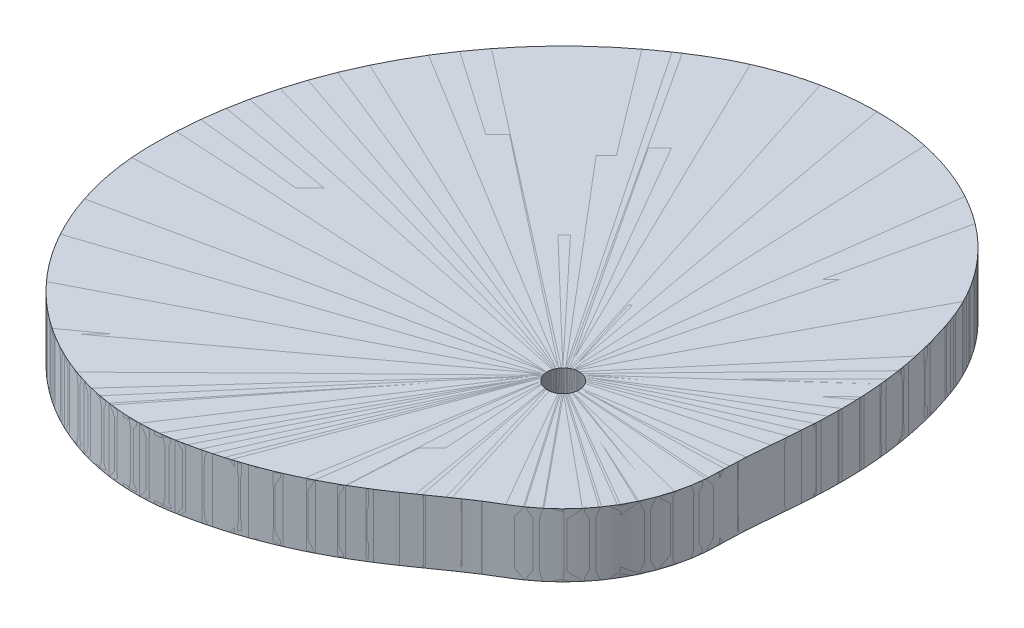
from build123d import *

# Parameters (mm, degrees)
SKETCH_1_W           = 125
SKETCH_1_H           = 20
EXTRUDE_1_DEPTH      = 10
EXTRUDE_1_DEPTH_BACK = 30
SKETCH_2_OUTSIDE_W   = 335.648
SKETCH_2_OUTSIDE_H   = 335.648
SKETCH_3_R           = 5
EXTRUDE_1_2_DEPTH    = 20


with BuildPart() as part:
    # 草图1 → 旋转1 (revolve)
    with BuildSketch(Plane.XY, mode=Mode.PRIVATE) as revolve_1_sk:
        with Locations((67.5, -10)):
            Rectangle(SKETCH_1_W, SKETCH_1_H)
    revolve(revolve_1_sk.sketch.rotate(Axis((0, -20200, 0), (0, 1, 0)), 90), axis=Axis((0, -20200, 0), (0, 1, 0)))

    # 草图2 outside → Extrude 1 (cut, two sides: drawn at the far end of the back side and taken through both)
    with BuildSketch(Plane(origin=(0, 0, 0), x_dir=(1, 0, 0), z_dir=(0, 1, 0)).offset(-EXTRUDE_1_DEPTH_BACK)):
        Rectangle(SKETCH_2_OUTSIDE_W, SKETCH_2_OUTSIDE_H)
        with BuildLine():
            ThreePointArc((49.5, 0), (49.522003902, 2.20101192), (49.586803675, 4.401179784))
            ThreePointArc((49.586803675, 4.401179784), (49.693801394, 6.656485153), (49.835800937, 8.909857504))
            ThreePointArc((49.835800937, 8.909857504), (50.014037902, 11.271336692), (50.212970941, 13.631162536))
            ThreePointArc((50.212970941, 13.631162536), (50.437148394, 16.148106857), (50.662964755, 18.664904667))
            ThreePointArc((50.662964755, 18.664904667), (50.89700113, 21.382651085), (51.110506521, 24.102087435))
            ThreePointArc((51.110506521, 24.102087435), (51.308533323, 27.06039267), (51.461958782, 30.021346081))
            ThreePointArc((51.461958782, 30.021346081), (51.569409755, 33.252730797), (51.607134457, 36.485681421))
            ThreePointArc((51.607134457, 36.485681421), (51.561933984, 40.013907512), (51.421470488, 43.539626224))
            ThreePointArc((51.421470488, 43.539626224), (51.155351471, 47.378376096), (50.768592452, 51.206853257))
            ThreePointArc((50.768592452, 51.206853257), (50.20855641, 55.358631163), (49.503236252, 59.488210272))
            ThreePointArc((49.503236252, 59.488210272), (48.573148745, 63.943471291), (47.474467997, 68.360179809))
            ThreePointArc((47.474467997, 68.360179809), (46.097521131, 73.094288239), (44.530735895, 77.769002062))
            ThreePointArc((44.530735895, 77.769002062), (42.604656504, 82.528401877), (40.298011434, 87.115455065))
            ThreePointArc((40.298011434, 87.115455065), (37.604302474, 91.545785765), (34.56817551, 95.748859775))
            ThreePointArc((34.56817551, 95.748859775), (31.174075456, 99.747159917), (27.481393941, 103.471461518))
            ThreePointArc((27.481393941, 103.471461518), (23.468076718, 106.944213921), (19.20439127, 110.104547889))
            ThreePointArc((19.20439127, 110.104547889), (14.664218285, 112.971648738), (9.924973663, 115.496128571))
            ThreePointArc((9.924973663, 115.496128571), (4.959489449, 117.692098926), (-0.151789418, 119.523259115))
            ThreePointArc((-0.151789418, 119.523259115), (-5.433965213, 120.998174308), (-10.807627759, 122.093850722))
            ThreePointArc((-10.807627759, 122.093850722), (-16.292977452, 122.813988134), (-21.815307765, 123.147944812))
            ThreePointArc((-21.815307765, 123.147944812), (-27.387630158, 123.096151544), (-32.942976067, 122.65844021))
            ThreePointArc((-32.942976067, 122.65844021), (-38.485608119, 121.834223171), (-43.958541912, 120.631268688))
            ThreePointArc((-43.958541912, 120.631268688), (-49.356557792, 119.050611025), (-54.634032237, 117.105021764))
            ThreePointArc((-54.634032237, 117.105021764), (-59.776394568, 114.79992941), (-64.75, 112.15028979))
            ThreePointArc((-64.75, 112.15028979), (-112.15028979, 64.75), (-129.5, 0))
            ThreePointArc((-129.5, 0), (-129.307852505, -5.632088462), (-128.732939877, -11.238051053))
            ThreePointArc((-128.732939877, -11.238051053), (-127.77913238, -16.781272621), (-126.449014131, -22.246420335))
            ThreePointArc((-126.449014131, -22.246420335), (-124.754336377, -27.587597274), (-122.696813244, -32.799765954))
            ThreePointArc((-122.696813244, -32.799765954), (-120.298209424, -37.829692306), (-117.556902514, -42.68136169))
            ThreePointArc((-117.556902514, -42.68136169), (-114.50652239, -47.29686169), (-111.140190251, -51.687245167))
            ThreePointArc((-111.140190251, -51.687245167), (-107.504475369, -55.793135236), (-103.586073445, -59.630176065))
            ThreePointArc((-103.586073445, -59.630176065), (-99.444602771, -63.141093315), (-95.06009455, -66.34334361))
            ThreePointArc((-95.06009455, -66.34334361), (-90.504208572, -69.185409931), (-85.751139909, -71.683764649))
            ThreePointArc((-85.751139909, -71.683764649), (-80.882367685, -73.796057576), (-75.868217271, -75.535316044))
            ThreePointArc((-75.868217271, -75.535316044), (-70.796536715, -76.871121243), (-65.636857194, -77.811348042))
            ThreePointArc((-65.636857194, -77.811348042), (-60.478824845, -78.339174116), (-55.295191431, -78.456829156))
            ThreePointArc((-55.295191431, -78.456829156), (-50.169364307, -78.160915791), (-45.084563465, -77.449249565))
            ThreePointArc((-45.084563465, -77.449249565), (-40.252749921, -76.46876847), (-35.464418323, -75.29418522))
            ThreePointArc((-35.464418323, -75.29418522), (-31.090096172, -74.0373164), (-26.766683195, -72.615165299))
            ThreePointArc((-26.766683195, -72.615165299), (-22.837702701, -71.161200919), (-18.962139542, -69.570317407))
            ThreePointArc((-18.962139542, -69.570317407), (-15.453201553, -67.991021962), (-11.995687137, -66.302112854))
            ThreePointArc((-11.995687137, -66.302112854), (-8.872093418, -64.660898454), (-5.793959756, -62.935930167))
            ThreePointArc((-5.793959756, -62.935930167), (-3.013004738, -61.286784304), (-0.268268971, -59.578036674))
            ThreePointArc((-0.268268971, -59.578036674), (2.219279173, -57.964689623), (4.682233258, -56.314040765))
            ThreePointArc((4.682233258, -56.314040765), (6.930581526, -54.769421498), (9.167200776, -53.207866842))
            ThreePointArc((9.167200776, -53.207866842), (11.233903436, -51.753905232), (13.301552432, -50.301289702))
            ThreePointArc((13.301552432, -50.301289702), (15.245755041, -48.949095714), (17.201737526, -47.613998381))
            ThreePointArc((17.201737526, -47.613998381), (19.082215454, -46.364336995), (20.981868338, -45.144021567))
            ThreePointArc((20.981868338, -45.144021567), (22.854869714, -43.987819385), (24.75, -42.868257487))
            ThreePointArc((24.75, -42.868257487), (42.868257487, -24.75), (49.5, 0))
        make_face(mode=Mode.SUBTRACT)
    extrude(amount=EXTRUDE_1_DEPTH + EXTRUDE_1_DEPTH_BACK, mode=Mode.SUBTRACT)


with BuildPart() as body_2:
    # 草图3 → Extrude 1 2 (new body)
    with BuildSketch(Plane(origin=(0, 0, 0), x_dir=(1, 0, 0), z_dir=(0, 1, 0))):
        with BuildLine():
            add(Edge.make_bspline(
                [(20.02967354, -45.750492484), (19.396443191, -46.157272465), (18.766389748, -46.568955942), (18.13955118, -46.985518105), (18.035079397, -47.054944261), (17.826315483, -47.194066912), (17.513570884, -47.40335867), (17.305649352, -47.543736891), (17.201737526, -47.613998381), (17.092747481, -47.687693583), (16.874875072, -47.835243239), (16.548389417, -48.057045545), (16.330949129, -48.205231269), (16.222283174, -48.279403522), (15.570284837, -48.724438817), (14.920243579, -49.172327875), (14.272171891, -49.623062092), (14.164160374, -49.698184161), (13.948247107, -49.848586124), (13.62459849, -50.074508861), (13.409231879, -50.225692444), (13.301552419, -50.301289712), (13.186656761, -50.38195317), (12.9568742, -50.543292558), (12.612226621, -50.785339047), (12.382479085, -50.946728306), (12.267609697, -51.027429169), (11.57839334, -51.511634363), (10.88933467, -51.996063929), (10.200433759, -52.480717816), (9.961671734, -52.648691093), (9.484185591, -52.984691533), (8.768046515, -53.488824211), (8.289727415, -53.823638559), (8.050365266, -53.99075555), (7.304821973, -54.511276242), (6.557318505, -55.028978047), (5.80786552, -55.543853584), (5.68295706, -55.629665918), (5.433032131, -55.801133368), (5.057820634, -56.057862938), (4.807464855, -56.228700698), (4.682233257, -56.314040766), (4.546114879, -56.406799717), (4.27375122, -56.592131397), (3.864130501, -56.868550928), (3.590697316, -57.052301325), (3.453865562, -57.14400469), (2.63286533, -57.694231389), (1.807742589, -58.238256445), (0.978544182, -58.776048973), (0.840346082, -58.86568), (0.563724765, -59.044594958), (0.148117104, -59.3119263), (-0.129399447, -59.489449478), (-0.268268971, -59.578036674), (-0.41970353, -59.674639318), (-0.72283723, -59.86742985), (-1.178907914, -60.154468013), (-1.483541683, -60.344879857), (-1.636029221, -60.439811661), (-2.550976623, -61.009416293), (-3.472014376, -61.569119467), (-4.39903533, -62.118856072), (-4.553535078, -62.210476619), (-4.862863975, -62.393162244), (-5.327846296, -62.665524676), (-5.638480806, -62.845981333), (-5.793959756, -62.935930167), (-5.963642857, -63.034096491), (-6.303394236, -63.229763347), (-6.814600367, -63.520535283), (-7.156191635, -63.712972575), (-7.327202959, -63.808806331), (-8.353309886, -64.383830713), (-9.387088209, -64.944946428), (-10.428349409, -65.492051151), (-10.601886349, -65.583231807), (-10.949370664, -65.764811972), (-11.471829806, -66.034839379), (-11.820934744, -66.213283902), (-11.995687137, -66.302112854), (-12.18626196, -66.398984556), (-12.567887137, -66.591792449), (-13.14202307, -66.877666185), (-13.525711142, -67.066335946), (-13.71780122, -67.160167133), (-14.870401126, -67.72318329), (-16.031716064, -68.267996424), (-17.201458575, -68.794471678), (-17.396405607, -68.882213029), (-17.786759816, -69.05667336), (-18.373673649, -69.315297494), (-18.765836243, -69.48565393), (-18.962139542, -69.570317407), (-19.175861758, -69.662493472), (-19.603832486, -69.845625312), (-20.247509004, -70.116339159), (-20.67762689, -70.294369789), (-20.892944236, -70.382755606), (-22.184931139, -70.913104507), (-23.486022019, -71.420709308), (-24.795816527, -71.905413816), (-25.014101617, -71.986192722), (-25.451144125, -72.146474185), (-26.108103512, -72.383136958), (-26.547007167, -72.538249405), (-26.766683196, -72.6151653), (-27.005339101, -72.698726681), (-27.483180144, -72.86433793), (-28.201533111, -73.108221176), (-28.681433591, -73.267766393), (-28.921634041, -73.346778353), (-30.362945144, -73.820885773), (-31.813003875, -74.267523452), (-33.271286745, -74.686530148), (-33.51431561, -74.756359344), (-34.000815598, -74.894478528), (-34.731874933, -75.09711935), (-35.220102317, -75.229002134), (-35.464418323, -75.29418522), (-35.729079727, -75.364796424), (-36.258877362, -75.504239109), (-37.055002901, -75.708064721), (-37.586627985, -75.840369547), (-37.852659941, -75.905627492), (-39.448987027, -76.297208363), (-41.052888459, -76.656507598), (-42.663711494, -76.983378972), (-42.932159237, -77.037852915), (-43.469421033, -77.14499562), (-44.276417304, -77.300294596), (-44.815071471, -77.400201977), (-45.084563465, -77.449249565), (-45.3652539, -77.500335272), (-45.926992572, -77.600540744), (-46.772616664, -77.734353434), (-47.337175116, -77.817276339), (-47.619722541, -77.856821538), (-49.315592201, -78.094174622), (-51.019714252, -78.262336522), (-52.729266892, -78.361028784), (-53.014094026, -78.377471819), (-53.58397133, -78.406494459), (-54.439473508, -78.438591884), (-55.009931036, -78.451994186), (-55.295191431, -78.456829156), (-55.583260451, -78.461711731), (-56.159463004, -78.467670662), (-57.023979274, -78.465186982), (-57.600138077, -78.455917417), (-57.888174288, -78.449379742), (-59.616957525, -78.410140844), (-61.342827543, -78.302419658), (-63.063072621, -78.126385437), (-63.34443353, -78.097593523), (-63.906781897, -78.036360241), (-64.749221659, -77.933699361), (-65.30977265, -77.857759724), (-65.589799881, -77.818039633), (-65.883563239, -77.776371158), (-66.470543519, -77.689181815), (-67.349393021, -77.546834209), (-67.933884612, -77.444279782), (-68.225781634, -77.39108861), (-69.94653127, -77.077523607), (-71.653881798, -76.697712477), (-73.345283839, -76.252222345), (-73.617145111, -76.180618131), (-74.15997792, -76.034031631), (-74.971614448, -75.804147739), (-75.51059716, -75.64398578), (-75.779598843, -75.562292396), (-76.071619007, -75.473608506), (-76.654505212, -75.29244041), (-77.525389581, -75.009278067), (-78.103362969, -74.813000276), (-78.39169887, -74.712985196), (-80.063875617, -74.13295721), (-81.712984665, -73.490269971), (-83.336679016, -72.785838149), (-83.593650873, -72.67435217), (-84.106262931, -72.448310786), (-84.871257719, -72.100155902), (-85.378268365, -71.861817267), (-85.63107713, -71.741188138), (-85.913702996, -71.606331611), (-86.477213616, -71.33296962), (-87.317272228, -70.911967977), (-87.873536365, -70.624146492), (-88.150727877, -70.478446362), (-89.735803666, -69.645283229), (-91.289058431, -68.754202034), (-92.808376806, -67.806416333), (-93.045212546, -67.658672759), (-93.517183702, -67.360459958), (-94.220120919, -66.905060112), (-94.685037697, -66.595965594), (-94.916626461, -66.44012601), (-95.182867737, -66.260968228), (-95.713051613, -65.899236668), (-96.501445694, -65.346377129), (-97.022172726, -64.971159828), (-97.281322025, -64.781888677), (-98.74346293, -63.714005825), (-100.166011218, -62.59392271), (-101.547104234, -61.423105946), (-101.758835264, -61.243611708), (-102.180305307, -60.88227345), (-102.806619608, -60.333291799), (-103.21989597, -59.962610695), (-103.425527214, -59.776159623), (-103.669131163, -59.555277736), (-104.153512732, -59.11039689), (-104.87161844, -58.433707985), (-105.344456405, -57.976577008), (-105.579403449, -57.746508369), (-106.886088596, -56.466955031), (-108.146436795, -55.141736092), (-109.358853165, -53.772528524), (-109.540904118, -53.566934514), (-109.9028091, -53.153801145), (-110.439159046, -52.528318934), (-110.792083771, -52.107488628), (-110.967442779, -51.896157928), (-111.182972851, -51.636415804), (-111.610699464, -51.114165441), (-112.242298994, -50.322472963), (-112.656479689, -49.789415886), (-112.861851265, -49.521569477), (-113.98442211, -48.057508213), (-115.054970903, -46.554988341), (-116.072181222, -45.015857466), (-116.220463011, -44.791493758), (-116.514732208, -44.341249986), (-116.949328664, -43.661369775), (-117.234265817, -43.205163293), (-117.375586175, -42.976350882), (-117.558505556, -42.680185311), (-117.920496942, -42.085477932), (-118.451949803, -41.186267173), (-118.798367915, -40.582355655), (-118.969608449, -40.279287635), (-119.883743587, -38.66141645), (-120.741253882, -37.012833328), (-121.54110888, -35.335519343), (-121.652068468, -35.102834582), (-121.871749153, -34.636397598), (-122.194618269, -33.933558122), (-122.405232605, -33.46295798), (-122.509421559, -33.227163811), (-122.656214719, -32.894950367), (-122.945361649, -32.228561873), (-123.365769234, -31.223070119), (-123.637003096, -30.549191967), (-123.770362804, -30.211361843), (-124.456473965, -28.473288017), (-125.082456746, -26.712664631), (-125.647571812, -24.931571115), (-125.718102316, -24.709277584), (-125.857255919, -24.264085331), (-126.060310956, -23.594488287), (-126.191767571, -23.146962924), (-126.256543805, -22.922924969), (-126.365052257, -22.547632829), (-126.576726028, -21.795503687), (-126.878209428, -20.66264513), (-127.068381121, -19.90479372), (-127.160764853, -19.525210369), (-127.604310219, -17.702785221), (-127.985335138, -15.866270608), (-128.303394751, -14.01781071), (-128.347923311, -13.75902508), (-128.434503926, -13.241027694), (-128.556971068, -12.462747808), (-128.633600133, -11.943185096), (-128.670677671, -11.683227309), (-128.721941532, -11.323806476), (-128.819739937, -10.604290273), (-128.952248312, -9.522968386), (-129.031078033, -8.801127705), (-129.068116767, -8.439963683), (-129.259828378, -6.570587247), (-129.387795304, -4.695768305), (-129.451869224, -2.81767988), (-129.462545632, -2.504740734), (-129.480347116, -1.878741283), (-129.49772869, -0.939363643), (-129.5, -0.313121214), (-129.5, 0), (-129.5, 0.314010981), (-129.497715763, 0.942032944), (-129.487436017, 1.884072118), (-129.476015104, 2.511994379), (-129.469162801, 2.825930587), (-128.481878812, 48.058050592), (-105.860432075, 87.239545681), (-67.181909078, 110.710618699), (-66.913458499, 110.873521071), (-66.375372325, 111.197373002), (-65.564682343, 111.67729511), (-65.021941488, 111.993284299), (-64.750000001, 112.15028979), (-64.478829074, 112.306850397), (-63.935351567, 112.618004599), (-63.11313588, 113.072640535), (-62.56210371, 113.370223723), (-62.285752256, 113.517447256), (-60.627243009, 114.401001826), (-58.939618715, 115.227588688), (-57.224835427, 115.996249781), (-56.893538843, 116.144755307), (-56.228991614, 116.437407106), (-55.226285203, 116.863312431), (-54.55426669, 117.138374629), (-54.217367188, 117.27368924), (-53.973698371, 117.371558043), (-53.485429331, 117.564976683), (-52.750185608, 117.848056969), (-52.258296405, 118.032074651), (-52.011917195, 118.122904602), (-50.252074159, 118.771686845), (-48.47109339, 119.359966893), (-46.671054232, 119.887057912), (-46.296133542, 119.996842928), (-45.544729122, 120.211075116), (-44.412903133, 120.516412111), (-43.655703304, 120.70916182), (-43.276436551, 120.802836814), (-43.050025874, 120.858757927), (-42.596729233, 120.96867584), (-41.915313664, 121.127623542), (-41.460189061, 121.229709113), (-41.232411964, 121.27977467), (-39.4073822, 121.680917425), (-37.569646231, 122.019112128), (-35.721374563, 122.293959346), (-35.36212524, 122.347381512), (-34.642912709, 122.449425174), (-33.561927515, 122.588087402), (-32.840244685, 122.670873062), (-32.479142823, 122.709853178), (-32.222844605, 122.737519982), (-31.70998576, 122.790422688), (-30.939874361, 122.862229569), (-30.426087741, 122.905199007), (-30.169097033, 122.925447566), (-28.316573013, 123.071409811), (-26.460103001, 123.153075672), (-24.601917886, 123.170347013), (-24.253833015, 123.17358237), (-23.557621242, 123.175531244), (-22.513155451, 123.164884945), (-21.81712806, 123.148744898), (-21.469181461, 123.138414853), (-21.200363922, 123.130434038), (-20.662808942, 123.111774466), (-19.85671718, 123.075343001), (-19.319660038, 123.045620286), (-19.051214472, 123.029386344), (-17.209682875, 122.918021804), (-15.3731881, 122.742159289), (-13.543988431, 122.502015052), (-13.209340848, 122.458081255), (-12.54060953, 122.365918789), (-11.539183966, 122.21478379), (-10.873038579, 122.10548686), (-10.540330265, 122.048703403), (-10.269633006, 122.002503398), (-9.728720908, 121.907276774), (-8.91886245, 121.755525201), (-8.380125967, 121.648672977), (-8.111050855, 121.593809231), (-6.319074133, 121.22842964), (-4.541226767, 120.799545551), (-2.779758497, 120.307699687), (-2.463039689, 120.219263899), (-1.830733668, 120.038339697), (-0.885651032, 119.754786364), (-0.258182133, 119.557740044), (0.054909167, 119.457213779), (0.319196154, 119.372357434), (0.846853588, 119.199790157), (1.635442794, 118.931876888), (2.159105926, 118.747542252), (2.420418012, 118.653924921), (4.124921581, 118.043271666), (5.806216156, 117.371350268), (7.462100287, 116.639040526), (7.755588562, 116.509246225), (8.340899792, 116.245892037), (9.213887237, 115.839552505), (9.792247896, 115.561265579), (10.080523725, 115.420272762), (10.331279145, 115.297630801), (10.831421239, 115.04954832), (11.577277683, 114.668486755), (12.071523122, 114.408854145), (12.317890681, 114.277620165), (13.898356363, 113.435744706), (15.446682697, 112.536127219), (16.96076103, 111.579992885), (17.2255368, 111.412788058), (17.752929586, 111.074959927), (18.53755701, 110.55794865), (19.056050749, 110.206615133), (19.31415286, 110.029282217), (19.545025133, 109.870657969), (20.004937768, 109.550743187), (20.688946136, 109.062315708), (21.141009746, 108.731401336), (21.366045364, 108.564600169), (22.787948394, 107.510655525), (24.169086393, 106.403828815), (25.507493737, 105.245695265), (25.738277288, 105.04599659), (26.197245535, 104.643595849), (26.877913502, 104.030969033), (27.326252779, 103.61675882), (27.549065362, 103.408203884), (27.75431475, 103.216088285), (28.16251043, 102.829396544), (28.767413985, 102.241440638), (29.165778022, 101.844626886), (29.363719727, 101.644990225), (30.595226518, 100.402938156), (31.77782787, 99.11423479), (32.909757946, 97.780804393), (33.101771363, 97.554609743), (33.482831897, 97.09970239), (34.045533291, 96.409770199), (34.414531616, 95.945025038), (34.597499253, 95.711452744), (34.771911477, 95.488802094), (35.117952627, 95.041320513), (35.628079439, 94.363076718), (35.9622832, 93.906685387), (36.127898184, 93.677415649), (37.14047083, 92.275656821), (38.096695123, 90.834870135), (38.995068624, 89.357319383), (39.144748522, 89.111141545), (39.440855602, 88.616808167), (39.875264667, 87.869356955), (40.158205358, 87.367371441), (40.298011434, 87.115455064), (40.436454424, 86.865994831), (40.710076454, 86.365262968), (41.110030358, 85.608327637), (41.369834667, 85.100288095), (41.498008148, 84.845399043), (42.267314461, 83.315536897), (42.973743009, 81.75564296), (43.616124039, 80.168300211), (43.723150605, 79.903834364), (43.933616489, 79.373450949), (44.240543346, 78.574212659), (44.434632197, 78.037629963), (44.530735895, 77.769002062), (44.623005434, 77.511091355), (44.805810188, 76.994649471), (45.074815465, 76.218120712), (45.250658059, 75.699266996), (45.337706112, 75.43954746), (45.860038715, 73.881098103), (46.350827167, 72.3124291), (46.809871728, 70.734178855), (46.886372668, 70.471159451), (47.037605869, 69.94460621), (47.259150481, 69.153228463), (47.40328839, 68.62468891), (47.474467997, 68.360179809), (47.540175791, 68.116004397), (47.670075641, 67.627245688), (47.860113209, 66.892809321), (47.983748482, 66.402428381), (48.044789056, 66.157044612), (48.411060048, 64.684631252), (48.749289838, 63.205524715), (49.059356319, 61.720258975), (49.111030179, 61.472733304), (49.212810209, 60.977354688), (49.360777606, 60.233301146), (49.456274578, 59.73667304), (49.503236252, 59.488210272), (49.546463147, 59.259507304), (49.631583656, 58.801849365), (49.755107375, 58.11457446), (49.834820811, 57.655943814), (49.874006771, 57.426513928), (50.109137607, 56.049846356), (50.320084395, 54.669266201), (50.506782225, 53.285198271), (50.537896535, 53.054535071), (50.59877643, 52.59302674), (50.686169621, 51.9002296), (50.741558159, 51.438030157), (50.768592452, 51.206853257), (50.793423381, 50.994517875), (50.841971677, 50.569716888), (50.911453523, 49.932122531), (50.955543549, 49.506835704), (50.977030826, 49.294135948), (51.105961137, 48.01787159), (51.214796591, 46.739736785), (51.30351025, 45.460047907), (51.318295097, 45.246777427), (51.346746327, 44.820158929), (51.386240376, 44.180005757), (51.410076432, 43.753104712), (51.421470488, 43.539626224), (51.431918555, 43.343871736), (51.451933534, 42.952315729), (51.479312511, 42.364839137), (51.495801633, 41.97311881), (51.503605338, 41.777241083), (51.55042935, 40.60193007), (51.581378047, 39.426093923), (51.596445788, 38.249947067), (51.598956983, 38.053930038), (51.603097034, 37.661884676), (51.606884216, 37.073781212), (51.607307437, 36.681714458), (51.607134457, 36.485681421), (51.606975957, 36.306058283), (51.606013163, 35.946812578), (51.602631538, 35.407944859), (51.599085595, 35.048715364), (51.596989748, 34.869104384), (51.584414359, 33.791412385), (51.560216068, 32.713918707), (51.524397688, 31.636748698), (51.518428102, 31.457224714), (51.505843493, 31.098198209), (51.485296494, 30.559710329), (51.469901846, 30.200793579), (51.461958782, 30.021346081), (51.454674781, 29.856787948), (51.439693475, 29.527689975), (51.415981572, 29.034097511), (51.399347333, 28.705078945), (51.390823635, 28.540580366), (51.339680848, 27.553577217), (51.2811027, 26.566987434), (51.215092517, 25.580867027), (51.204090949, 25.41651557), (51.181675031, 25.087840287), (51.147099053, 24.594888572), (51.12277894, 24.266348884), (51.110506521, 24.102087435), (51.099215654, 23.950963657), (51.076443703, 23.648730312), (51.041715123, 23.195422839), (51.018182419, 22.893247776), (51.006320987, 22.74216771), (50.935152186, 21.835684618), (50.860561005, 20.929476723), (50.782548509, 20.023556944), (50.757502024, 19.732704747), (50.706703843, 19.151061082), (50.628181675, 18.278800111), (50.57593983, 17.697284761), (50.549851717, 17.406524143), (50.474579594, 16.56759151), (50.399580619, 15.728634414), (50.324854798, 14.889652943), (50.312400496, 14.749822703), (50.287507065, 14.470160871), (50.250212446, 14.050664068), (50.225379718, 13.770996839), (50.212970943, 13.631162552), (50.201341519, 13.500110769), (50.178096001, 13.238006022), (50.144265479, 12.844756729), (50.121970193, 12.582569373), (50.110918331, 12.451467621), (50.044606893, 11.664853968), (49.981744219, 10.877957195), (49.922331516, 10.090792424), (49.912429439, 9.959598821), (49.892816981, 9.697197146), (49.863973377, 9.303551122), (49.845127831, 9.041093253), (49.835800937, 8.909857504), (49.826908615, 8.784736478), (49.809298275, 8.534482039), (49.784418595, 8.158991391), (49.768316802, 7.908635214), (49.760427879, 7.783446918), (49.713093747, 7.032307712), (49.67159212, 6.280823686), (49.635925497, 5.529040127), (49.629981134, 5.403744441), (49.618416634, 5.153137685), (49.602042556, 4.777181091), (49.59177519, 4.526517841), (49.586803675, 4.401179784), (49.58195703, 4.278989872), (49.572571986, 4.03459782), (49.560251719, 3.667940682), (49.552655486, 3.423486365), (49.549055457, 3.301253372), (49.527454851, 2.567840971), (49.512986432, 1.834253211), (49.505651567, 1.100559449), (49.503203199, 0.855653421), (49.499896253, 0.365825472), (49.500442653, -0.368978597), (49.493156006, -0.85877442), (49.487695408, -1.103631805), (49.102520818, -18.375155434), (40.464611813, -33.336452702), (25.699620884, -42.305785496), (25.490298467, -42.432943205), (25.069766165, -42.684151538), (24.433133974, -43.051080376), (24.010584, -43.29885825), (23.799713343, -43.423431613), (23.167983339, -43.796630673), (22.539911912, -44.175954571), (21.915558444, -44.561367445), (21.811501582, -44.625601659), (21.60359605, -44.754407347), (21.292221787, -44.948405581), (21.085264583, -45.078729293), (20.981868338, -45.144021567), (20.875808154, -45.210996054), (20.663861095, -45.345219479), (20.346460172, -45.547378143), (20.135210606, -45.682696672), (20.02967354, -45.750492484)],
                knots=[0, 0, 0, 0, 0.003776693, 0.003776693, 0.003776693, 0.004406147, 0.0050356, 0.005665054, 0.005665054, 0.005665054, 0.006325269, 0.006985485, 0.0076457, 0.0076457, 0.0076457, 0.011606982, 0.011606982, 0.011606982, 0.012267198, 0.012927413, 0.013587628, 0.013587628, 0.013587628, 0.014292088, 0.014996548, 0.015701008, 0.015701008, 0.015701008, 0.019927768, 0.019927768, 0.019927768, 0.021392695, 0.022857623, 0.02432255, 0.02432255, 0.02432255, 0.02888535, 0.02888535, 0.02888535, 0.029645818, 0.030406286, 0.031166754, 0.031166754, 0.031166754, 0.031993332, 0.03281991, 0.033646488, 0.033646488, 0.033646488, 0.03860592, 0.03860592, 0.03860592, 0.039432498, 0.040259076, 0.041085654, 0.041085654, 0.041085654, 0.041987021, 0.042888389, 0.043789756, 0.043789756, 0.043789756, 0.049197882, 0.049197882, 0.049197882, 0.050099249, 0.051000617, 0.051901984, 0.051901984, 0.051901984, 0.052885698, 0.053869412, 0.054853126, 0.054853126, 0.054853126, 0.060755275, 0.060755275, 0.060755275, 0.061738989, 0.062722703, 0.063706417, 0.063706417, 0.063706417, 0.064779199, 0.06585198, 0.066924761, 0.066924761, 0.066924761, 0.073361251, 0.073361251, 0.073361251, 0.074434032, 0.075506813, 0.076579595, 0.076579595, 0.076579595, 0.077747569, 0.078915543, 0.080083518, 0.080083518, 0.080083518, 0.087091094, 0.087091094, 0.087091094, 0.088259069, 0.089427043, 0.090595017, 0.090595017, 0.090595017, 0.091863904, 0.09313279, 0.094401677, 0.094401677, 0.094401677, 0.102014653, 0.102014653, 0.102014653, 0.10328354, 0.104552426, 0.105821313, 0.105821313, 0.105821313, 0.107195866, 0.108570419, 0.109944972, 0.109944972, 0.109944972, 0.118191871, 0.118191871, 0.118191871, 0.119566424, 0.120940977, 0.12231553, 0.12231553, 0.12231553, 0.123747201, 0.125178872, 0.126610543, 0.126610543, 0.126610543, 0.135198792, 0.135198792, 0.135198792, 0.136630463, 0.138062134, 0.139493805, 0.139493805, 0.139493805, 0.140939572, 0.142385339, 0.143831106, 0.143831106, 0.143831106, 0.152504005, 0.152504005, 0.152504005, 0.153923275, 0.155342546, 0.156761817, 0.156761817, 0.156761817, 0.158250707, 0.159739596, 0.161228486, 0.161228486, 0.161228486, 0.170001209, 0.170001209, 0.170001209, 0.171411962, 0.172822715, 0.174233469, 0.174233469, 0.174233469, 0.17576494, 0.177296412, 0.178827883, 0.178827883, 0.178827883, 0.187705294, 0.187705294, 0.187705294, 0.189110933, 0.190516572, 0.19192221, 0.19192221, 0.19192221, 0.193493634, 0.195065059, 0.196636483, 0.196636483, 0.196636483, 0.205618345, 0.205618345, 0.205618345, 0.207019099, 0.208419854, 0.209820608, 0.209820608, 0.209820608, 0.211430957, 0.213041305, 0.214651654, 0.214651654, 0.214651654, 0.223733403, 0.223733403, 0.223733403, 0.225126306, 0.226519208, 0.22791211, 0.22791211, 0.22791211, 0.229562232, 0.231212353, 0.232862475, 0.232862475, 0.232862475, 0.242035944, 0.242035944, 0.242035944, 0.243413972, 0.244792, 0.246170028, 0.246170028, 0.246170028, 0.247863734, 0.249557439, 0.251251144, 0.251251144, 0.251251144, 0.260505223, 0.260505223, 0.260505223, 0.261854771, 0.263204319, 0.264553867, 0.264553867, 0.264553867, 0.266300668, 0.268047468, 0.269794269, 0.269794269, 0.269794269, 0.279115497, 0.279115497, 0.279115497, 0.280409099, 0.281702701, 0.282996303, 0.282996303, 0.282996303, 0.284818876, 0.286641448, 0.288464021, 0.288464021, 0.288464021, 0.29783713, 0.29783713, 0.29783713, 0.299007424, 0.300177718, 0.301348011, 0.301348011, 0.301348011, 0.303308402, 0.305268793, 0.307229184, 0.307229184, 0.307229184, 0.316637592, 0.316637592, 0.316637592, 0.317955288, 0.319272985, 0.320590681, 0.320590681, 0.320590681, 0.322412544, 0.324234407, 0.326056271, 0.326056271, 0.326056271, 0.335482548, 0.335482548, 0.335482548, 0.337053822, 0.338625096, 0.34019637, 0.34019637, 0.34019637, 0.341772108, 0.343347847, 0.344923586, 0.344923586, 0.344923586, 0.553299408, 0.553299408, 0.553299408, 0.554875147, 0.556450886, 0.558026624, 0.558026624, 0.558026624, 0.559597898, 0.561169172, 0.562740446, 0.562740446, 0.562740446, 0.572166723, 0.572166723, 0.572166723, 0.573988587, 0.57581045, 0.577632313, 0.577632313, 0.577632313, 0.578950009, 0.580267706, 0.581585402, 0.581585402, 0.581585402, 0.59099381, 0.59099381, 0.59099381, 0.592954201, 0.594914592, 0.596874983, 0.596874983, 0.596874983, 0.598045277, 0.59921557, 0.600385864, 0.600385864, 0.600385864, 0.609758973, 0.609758973, 0.609758973, 0.611581546, 0.613404118, 0.615226691, 0.615226691, 0.615226691, 0.616520293, 0.617813895, 0.619107497, 0.619107497, 0.619107497, 0.628428726, 0.628428726, 0.628428726, 0.630175526, 0.631922327, 0.633669127, 0.633669127, 0.633669127, 0.635018675, 0.636368223, 0.637717771, 0.637717771, 0.637717771, 0.64697185, 0.64697185, 0.64697185, 0.648665555, 0.65035926, 0.652052966, 0.652052966, 0.652052966, 0.653430994, 0.654809022, 0.65618705, 0.65618705, 0.65618705, 0.66536052, 0.66536052, 0.66536052, 0.667010641, 0.668660762, 0.670310884, 0.670310884, 0.670310884, 0.671703786, 0.673096689, 0.674489591, 0.674489591, 0.674489591, 0.68357134, 0.68357134, 0.68357134, 0.685181689, 0.686792037, 0.688402386, 0.688402386, 0.688402386, 0.689803141, 0.691203895, 0.692604649, 0.692604649, 0.692604649, 0.701586511, 0.701586511, 0.701586511, 0.703157935, 0.70472936, 0.706300784, 0.706300784, 0.706300784, 0.707706423, 0.709112061, 0.7105177, 0.7105177, 0.7105177, 0.719395111, 0.719395111, 0.719395111, 0.720926582, 0.722458054, 0.723989525, 0.723989525, 0.723989525, 0.725400279, 0.726811032, 0.728221785, 0.728221785, 0.728221785, 0.736994508, 0.736994508, 0.736994508, 0.738483398, 0.739972288, 0.741461177, 0.741461177, 0.741461177, 0.742880448, 0.744299719, 0.745718989, 0.745718989, 0.745718989, 0.754391888, 0.754391888, 0.754391888, 0.755837655, 0.757283422, 0.758729189, 0.758729189, 0.758729189, 0.76016086, 0.761592531, 0.763024202, 0.763024202, 0.763024202, 0.771612451, 0.771612451, 0.771612451, 0.773044122, 0.774475793, 0.775907464, 0.775907464, 0.775907464, 0.777282017, 0.77865657, 0.780031123, 0.780031123, 0.780031123, 0.788278022, 0.788278022, 0.788278022, 0.789652575, 0.791027128, 0.792401681, 0.792401681, 0.792401681, 0.793670568, 0.794939454, 0.796208341, 0.796208341, 0.796208341, 0.803821317, 0.803821317, 0.803821317, 0.805090204, 0.80635909, 0.807627977, 0.807627977, 0.807627977, 0.808795951, 0.809963926, 0.8111319, 0.8111319, 0.8111319, 0.818139476, 0.818139476, 0.818139476, 0.819307451, 0.820475425, 0.821643399, 0.821643399, 0.821643399, 0.822716181, 0.823788962, 0.824861743, 0.824861743, 0.824861743, 0.831298233, 0.831298233, 0.831298233, 0.832371014, 0.833443795, 0.834516577, 0.834516577, 0.834516577, 0.835500291, 0.836484005, 0.837467719, 0.837467719, 0.837467719, 0.843369868, 0.843369868, 0.843369868, 0.844353582, 0.845337296, 0.84632101, 0.84632101, 0.84632101, 0.847222377, 0.848123745, 0.849025112, 0.849025112, 0.849025112, 0.854433238, 0.854433238, 0.854433238, 0.855334605, 0.856235973, 0.85713734, 0.85713734, 0.85713734, 0.857963918, 0.858790496, 0.859617074, 0.859617074, 0.859617074, 0.864576506, 0.864576506, 0.864576506, 0.865403084, 0.866229662, 0.86705624, 0.86705624, 0.86705624, 0.867816708, 0.868577176, 0.869337644, 0.869337644, 0.869337644, 0.873900444, 0.873900444, 0.873900444, 0.875365371, 0.876830299, 0.878295226, 0.878295226, 0.878295226, 0.882521986, 0.882521986, 0.882521986, 0.883226446, 0.883930906, 0.884635366, 0.884635366, 0.884635366, 0.885295581, 0.885955797, 0.886616012, 0.886616012, 0.886616012, 0.890577294, 0.890577294, 0.890577294, 0.891237509, 0.891897725, 0.89255794, 0.89255794, 0.89255794, 0.893187394, 0.893816847, 0.894446301, 0.894446301, 0.894446301, 0.898222994, 0.898222994, 0.898222994, 0.898852448, 0.899481901, 0.900111355, 0.900111355, 0.900111355, 0.900724998, 0.901338642, 0.901952285, 0.901952285, 0.901952285, 0.905634103, 0.905634103, 0.905634103, 0.906863127, 0.908092152, 0.909321177, 0.909321177, 0.909321177, 0.988901818, 0.988901818, 0.988901818, 0.990130842, 0.991359867, 0.992588891, 0.992588891, 0.992588891, 0.996270709, 0.996270709, 0.996270709, 0.996884352, 0.997497996, 0.998111639, 0.998111639, 0.998111639, 0.998741093, 0.999370546, 1, 1, 1, 1], degree=3, weights=[1, 0.999979912, 0.999979912, 1, 1, 1, 1, 1, 1, 1, 1, 1, 1, 1, 0.999993595, 0.999993595, 1, 1, 1, 1, 1, 1, 1, 1, 1, 1, 1, 0.999999965, 0.999999965, 1, 1, 1, 1, 1, 1, 0.999995247, 0.999995247, 1, 1, 1, 1, 1, 1, 1, 1, 1, 1, 1, 0.999981076, 0.999981076, 1, 1, 1, 1, 1, 1, 1, 1, 1, 1, 1, 0.999961222, 0.999961222, 1, 1, 1, 1, 1, 1, 1, 1, 1, 1, 1, 0.999939214, 0.999939214, 1, 1, 1, 1, 1, 1, 1, 1, 1, 1, 1, 0.99991749, 0.99991749, 1, 1, 1, 1, 1, 1, 1, 1, 1, 1, 1, 0.999897432, 0.999897432, 1, 1, 1, 1, 1, 1, 1, 1, 1, 1, 1, 0.999879662, 0.999879662, 1, 1, 1, 1, 1, 1, 1, 1, 1, 1, 1, 0.999864343, 0.999864343, 1, 1, 1, 1, 1, 1, 1, 1, 1, 1, 1, 0.999448044, 0.999448044, 1, 1, 1, 1, 1, 1, 1, 1, 1, 1, 1, 0.99947626, 0.99947626, 1, 1, 1, 1, 1, 1, 1, 1, 1, 1, 1, 0.999502274, 0.999502274, 1, 1, 1, 1, 1, 1, 1, 1, 1, 1, 1, 0.999525603, 0.999525603, 1, 1, 1, 1, 1, 1, 1, 1, 1, 1, 1, 0.999546036, 0.999546036, 1, 1, 1, 1, 1, 1, 1, 1, 1, 1, 1, 0.999563541, 0.999563541, 1, 1, 1, 1, 1, 1, 1, 1, 1, 1, 1, 0.99957819, 0.99957819, 1, 1, 1, 1, 1, 1, 1, 1, 1, 1, 1, 0.99959011, 0.99959011, 1, 1, 1, 1, 1, 1, 1, 1, 1, 1, 1, 0.999599439, 0.999599439, 1, 1, 1, 1, 1, 1, 1, 1, 1, 1, 1, 0.999606308, 0.999606308, 1, 1, 1, 1, 1, 1, 1, 1, 1, 1, 1, 0.999610824, 0.999610824, 1, 1, 1, 1, 1, 1, 1, 1, 1, 1, 1, 0.999613647, 0.999613647, 1, 1, 1, 1, 1, 1, 1, 1, 1, 1, 1, 0.917820074, 0.917820074, 1, 1, 1, 1, 1, 1, 1, 1, 1, 1, 1, 0.999613647, 0.999613647, 1, 1, 1, 1, 1, 1, 1, 1, 1, 1, 1, 0.999610824, 0.999610824, 1, 1, 1, 1, 1, 1, 1, 1, 1, 1, 1, 0.999606308, 0.999606308, 1, 1, 1, 1, 1, 1, 1, 1, 1, 1, 1, 0.999599439, 0.999599439, 1, 1, 1, 1, 1, 1, 1, 1, 1, 1, 1, 0.99959011, 0.99959011, 1, 1, 1, 1, 1, 1, 1, 1, 1, 1, 1, 0.99957819, 0.99957819, 1, 1, 1, 1, 1, 1, 1, 1, 1, 1, 1, 0.999563541, 0.999563541, 1, 1, 1, 1, 1, 1, 1, 1, 1, 1, 1, 0.999546036, 0.999546036, 1, 1, 1, 1, 1, 1, 1, 1, 1, 1, 1, 0.999525603, 0.999525603, 1, 1, 1, 1, 1, 1, 1, 1, 1, 1, 1, 0.999502274, 0.999502274, 1, 1, 1, 1, 1, 1, 1, 1, 1, 1, 1, 0.99947626, 0.99947626, 1, 1, 1, 1, 1, 1, 1, 1, 1, 1, 1, 0.999448044, 0.999448044, 1, 1, 1, 1, 1, 1, 1, 1, 1, 1, 1, 0.999864343, 0.999864343, 1, 1, 1, 1, 1, 1, 1, 1, 1, 1, 1, 0.999879662, 0.999879662, 1, 1, 1, 1, 1, 1, 1, 1, 1, 1, 1, 0.999897432, 0.999897432, 1, 1, 1, 1, 1, 1, 1, 1, 1, 1, 1, 0.99991749, 0.99991749, 1, 1, 1, 1, 1, 1, 1, 1, 1, 1, 1, 0.999939214, 0.999939214, 1, 1, 1, 1, 1, 1, 1, 1, 1, 1, 1, 0.999961222, 0.999961222, 1, 1, 1, 1, 1, 1, 1, 1, 1, 1, 1, 0.999981076, 0.999981076, 1, 1, 1, 1, 1, 1, 1, 1, 1, 1, 1, 0.999995247, 0.999995247, 1, 1, 1, 1, 1, 1, 0.999999965, 0.999999965, 1, 1, 1, 1, 1, 1, 1, 1, 1, 1, 1, 0.999993595, 0.999993595, 1, 1, 1, 1, 1, 1, 1, 1, 1, 1, 1, 0.999979912, 0.999979912, 1, 1, 1, 1, 1, 1, 1, 1, 1, 1, 1, 0.999968485, 0.999968485, 1, 1, 1, 1, 1, 1, 0.91797195, 0.91797195, 1, 1, 1, 1, 1, 1, 0.999968485, 0.999968485, 1, 1, 1, 1, 1, 1, 1, 1, 1, 1, 1]))
        make_face()
        with Locations(Location((0, 0, 0), (0, 0, 270))):
            Circle(SKETCH_3_R, mode=Mode.SUBTRACT)
    extrude(amount=-EXTRUDE_1_2_DEPTH)


solid = Compound([part.part, body_2.part])
